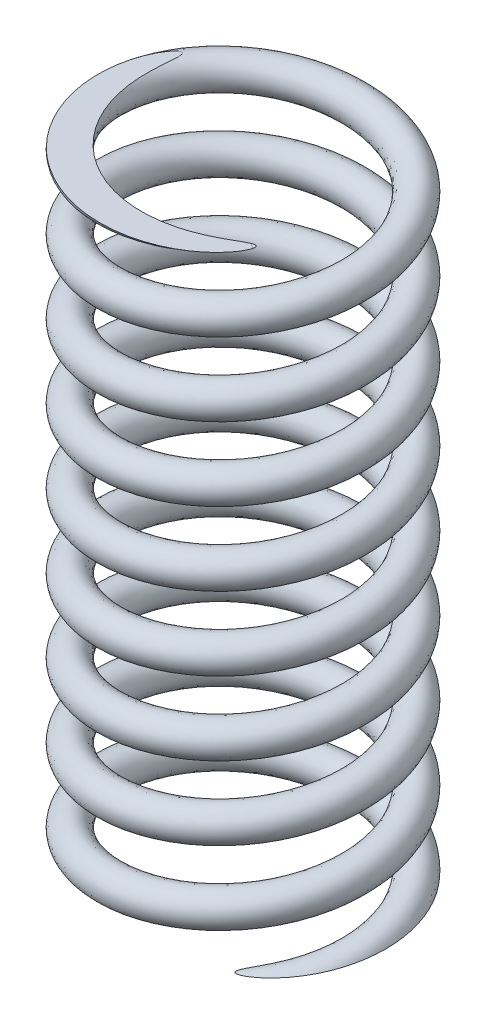
from build123d import *

# Parameters (mm, degrees)
SWEEP2_PITCH       = 8.57025641
SWEEP2_HEIGHT      = 83.56
SWEEP2_RADIUS      = 14.3
SWEEP2_START_ANGLE = -90
SKETCH3_R          = 1.95


with BuildPart() as part:
    # Sweep2: sweep along a helix
    with BuildLine() as sweep2_path:
        add(Helix(SWEEP2_PITCH, SWEEP2_HEIGHT, SWEEP2_RADIUS, center=(0, 0, 0), direction=(0, 1, 0), mode=Mode.PRIVATE).rotate(Axis((0, 0, 0), (0, 1, 0)), SWEEP2_START_ANGLE))
    # Sketch3 → Sweep2 (sweep)
    with BuildSketch(Plane.XY):
        with Locations((-14.3, 0)):
            Circle(SKETCH3_R)
    sweep(path=sweep2_path.line, is_frenet=True)

    # SurfaceCut2
    split(bisect_by=Plane(origin=(0, 78.5, 0), x_dir=(1, 0, 0), z_dir=(0, 1, 0)), keep=Keep.BOTTOM)

    # SurfaceCut3
    split(bisect_by=Plane(origin=(0, 5.1, 0), x_dir=(1, 0, 0), z_dir=(0, 1, 0)), keep=Keep.TOP)


solid = part.part
